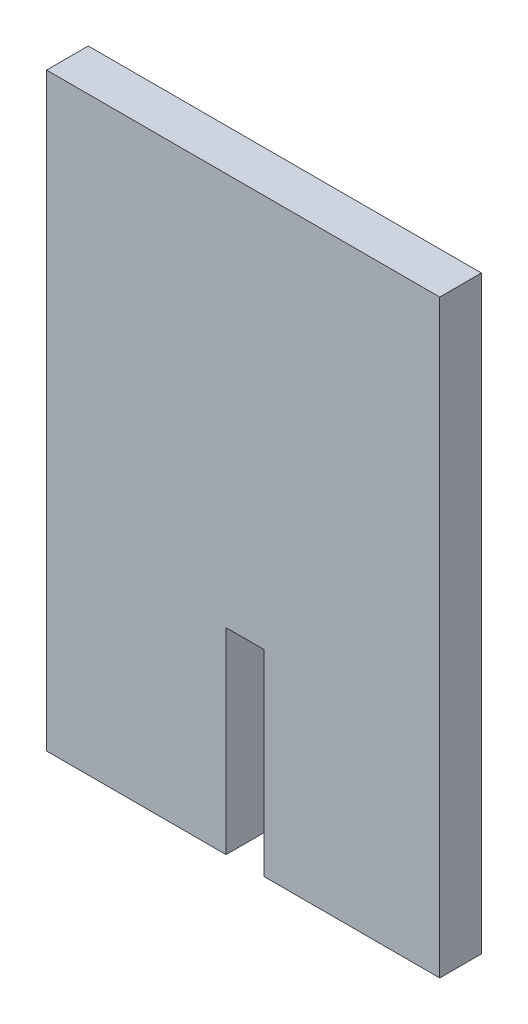
from build123d import *

# Parameters (mm, degrees)
BOSS_EXTRUDE1_DEPTH = 2.6924


with BuildPart() as part:
    # Sketch1 → Boss-Extrude1 (new body)
    with BuildSketch(Plane.XY):
        Polygon((1.3335, -19.05), (12.7, -19.05), (12.7, 19.05), (-12.7, 19.05), (-12.7, -19.05), (-1.1049, -19.05), (-1.1049, -6.35), (1.3335, -6.35), align=None)
    extrude(amount=BOSS_EXTRUDE1_DEPTH)


solid = part.part
